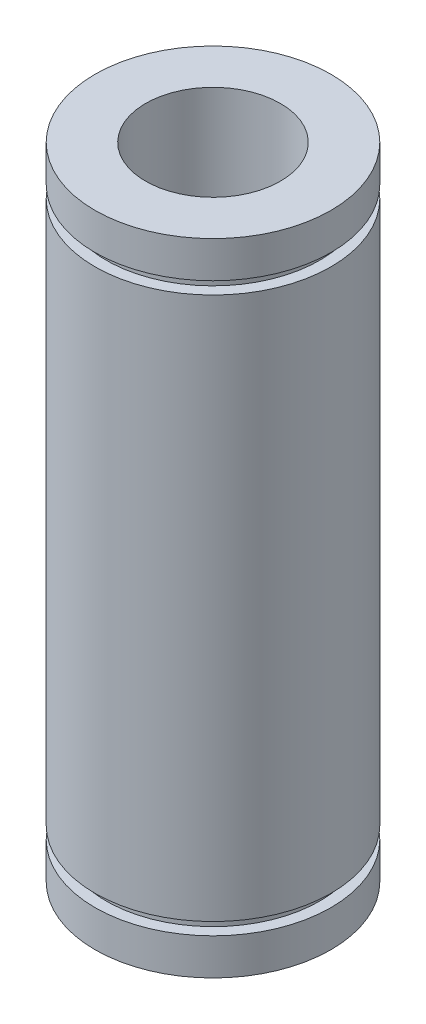
from build123d import *


with BuildPart() as part:
    # Sketch1 → Revolve1 (revolve)
    with BuildSketch(Plane.XY, mode=Mode.PRIVATE) as revolve1_sk:
        Polygon((6, -16.5), (6, 12), (10.5, 12), (10.5, 8.75), (9.5, 8.75), (9.5, 7.65), (10.5, 7.65), (10.5, -16.5), align=None)
    revolve1 = revolve(revolve1_sk.sketch.rotate(Axis((0, 0, 0), (0, 1, 0)), 90), axis=Axis((0, 0, 0), (0, 1, 0)))

    # Mirror1: Revolve1 across plane
    add(revolve1.mirror(Plane(origin=(6, -16.5, 0), x_dir=(0, 0, 1), z_dir=(0, -1, 0))))


solid = part.part
